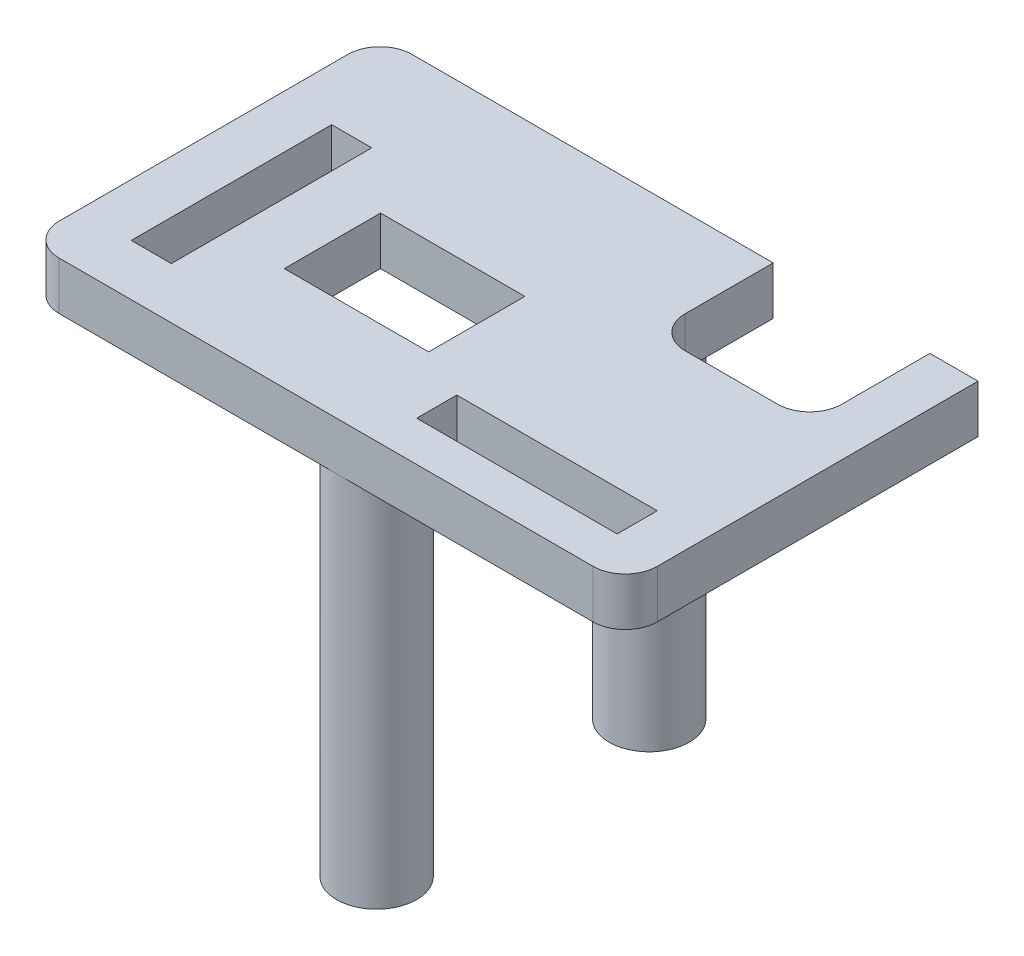
from build123d import *

# Parameters (mm, degrees)
SKETCH1_W           = 12.5
SKETCH1_H           = 2.5
SKETCH1_W_2         = 2.5
SKETCH1_H_2         = 12.5
SKETCH1_W_3         = 9
SKETCH1_H_3         = 6
BOSS_EXTRUDE1_DEPTH = 3
FILLET1_R           = 2
SKETCH1_6_R         = 2.5
BOSS_EXTRUDE4_DEPTH = 23
SKETCH3_R           = 1
CUT_EXTRUDE1_DEPTH  = 10


with BuildPart() as part:
    # Sketch1 → Boss-Extrude1 (new body)
    with BuildSketch(Plane(origin=(0, 0, 0), x_dir=(1, 0, 0), z_dir=(0, 1, 0))):
        Polygon((-38.561763486, -34.640037485), (-1.270220731, -34.640037485), (-1.270220731, -12.640037485), (-4.270220731, -12.640037485), (-4.270220731, -20.13144272), (-14.041444449, -20.13144272), (-14.041444449, -12.640037485), (-38.561763486, -12.640037485), align=None)
        with Locations((-10.520220731, -30.890037485)):
            Rectangle(SKETCH1_W, SKETCH1_H, mode=Mode.SUBTRACT)
        with Locations((-34.020220731, -25.190037485)):
            Rectangle(SKETCH1_W_2, SKETCH1_H_2, mode=Mode.SUBTRACT)
        with Locations((-24.475907507, -25.190037485)):
            Rectangle(SKETCH1_W_3, SKETCH1_H_3, mode=Mode.SUBTRACT)
    extrude(amount=BOSS_EXTRUDE1_DEPTH)

    # Fillet1
    fillet1_edges = [part.edges().sort_by_distance(p)[0] for p in [
        (-38.561763486, 1.5, 12.640037485),
        (-38.561763486, 1.5, 34.640037485),
        (-1.270220731, 1.5, 34.640037485),
        (-14.041444449, 1.5, 20.13144272),
        (-4.270220731, 1.5, 20.13144272),
    ]]
    fillet(fillet1_edges, radius=FILLET1_R)

    # Sketch1<6> → Boss-Extrude4 (add)
    with BuildSketch(Plane(origin=(0, 0, 0), x_dir=(1, 0, 0), z_dir=(0, 1, 0))):
        with Locations((-19.270220731, -15.140037485)):
            Circle(SKETCH1_6_R)
        with Locations((-19.270220731, -32.140037485)):
            Circle(SKETCH1_6_R)
    extrude(amount=-BOSS_EXTRUDE4_DEPTH)

    # Sketch3 → Cut-Extrude1 (cut)
    with BuildSketch(Plane(origin=(0, -23, 0), x_dir=(-1, 0, 0), z_dir=(0, -1, 0))):
        with Locations((19.270220731, -32.140037485)):
            Circle(SKETCH3_R)
        with Locations((19.270220731, -15.140037485)):
            Circle(SKETCH3_R)
    extrude(amount=-CUT_EXTRUDE1_DEPTH, mode=Mode.SUBTRACT)


solid = part.part
